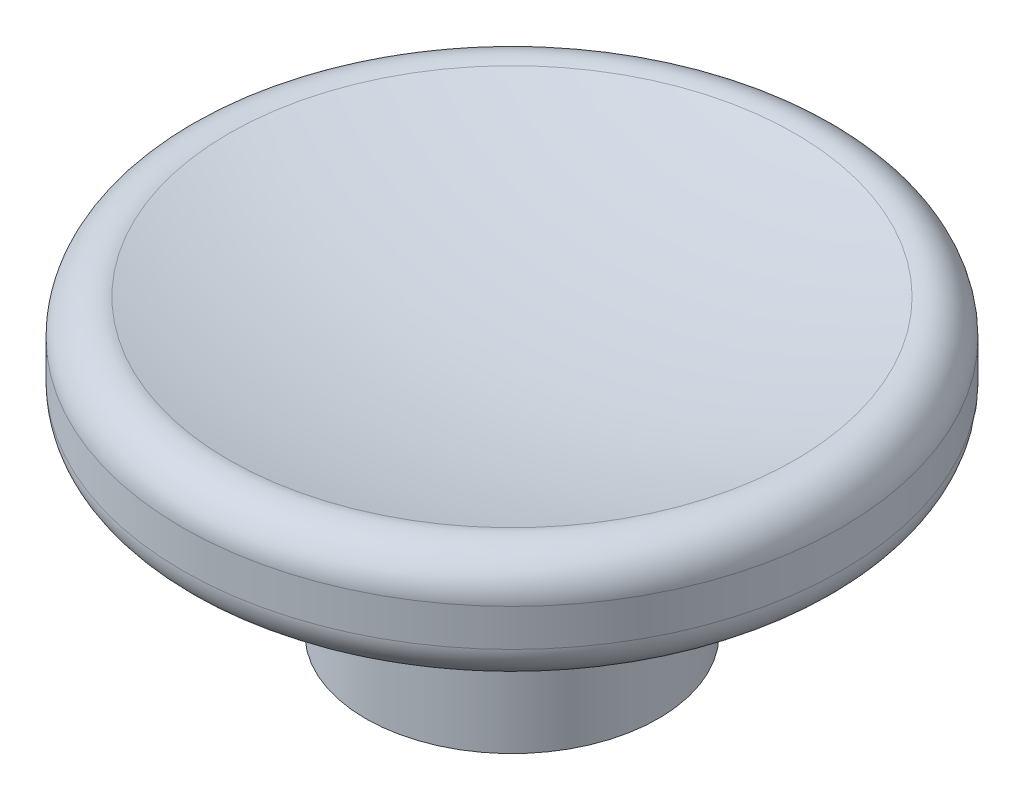
from build123d import *

# Parameters (mm, degrees)
SKETCH_1_R      = 2
SKETCH_1_W      = 1.855595784
SKETCH_1_H      = 1.9
EXTRUDE_1_DEPTH = 2.5
SKETCH_2_R      = 4.5
EXTRUDE_2_DEPTH = 2
FILLET_2_R      = 0.5
SKETCH_4_W      = 1.855595784
SKETCH_4_H      = 1.9
EXTRUDE_3_DEPTH = 0.5


with BuildPart() as part:
    # 草图1 → 凸台-拉伸1 (new body)
    with BuildSketch(Plane(origin=(0, 0, 0), x_dir=(1, 0, 0), z_dir=(0, 1, 0))):
        with Locations(Location((0, 0, 0), (0, 0, 270))):
            Circle(SKETCH_1_R)
        Rectangle(SKETCH_1_W, SKETCH_1_H, mode=Mode.SUBTRACT)
    extrude(amount=EXTRUDE_1_DEPTH)

    # 草图2 → 凸台-拉伸2 (add)
    with BuildSketch(Plane(origin=(0, 2.5, 0), x_dir=(1, 0, 0), z_dir=(0, 1, 0))):
        with Locations(Location((0, 0, 0), (0, 0, 270))):
            Circle(SKETCH_2_R)
    extrude(amount=EXTRUDE_2_DEPTH)

    # 草图3 → 切除-旋转6 (revolve, cut)
    with BuildSketch(Plane.XY, mode=Mode.PRIVATE) as cut_revolve_6_sk:
        with BuildLine():
            Line((-5.348495513, 4.5), (0, 4.5))
            Line((0, 4.5), (0, 3.454223495))
            ThreePointArc((0, 3.454223495), (-2.724887739, 3.718119778), (-5.348495513, 4.5))
        make_face()
    revolve(cut_revolve_6_sk.sketch.rotate(Axis((0, 4.5, 0), (0, -1, 0)), 270), axis=Axis((0, 4.5, 0), (0, -1, 0)), mode=Mode.SUBTRACT)

    # 圆角2
    fillet_2_edges = [part.edges().sort_by_distance(p)[0] for p in [
        (0, 2.5, -4.5),
        (0, 4.186113011, -4.5),
        (0, 2.5, -2),
    ]]
    fillet(fillet_2_edges, radius=FILLET_2_R)

    # 草图4 → 凸台-拉伸3 (add)
    with BuildSketch(Plane.XZ.offset(-2.5)):
        Rectangle(SKETCH_4_W, SKETCH_4_H)
    extrude(amount=EXTRUDE_3_DEPTH)


solid = part.part
